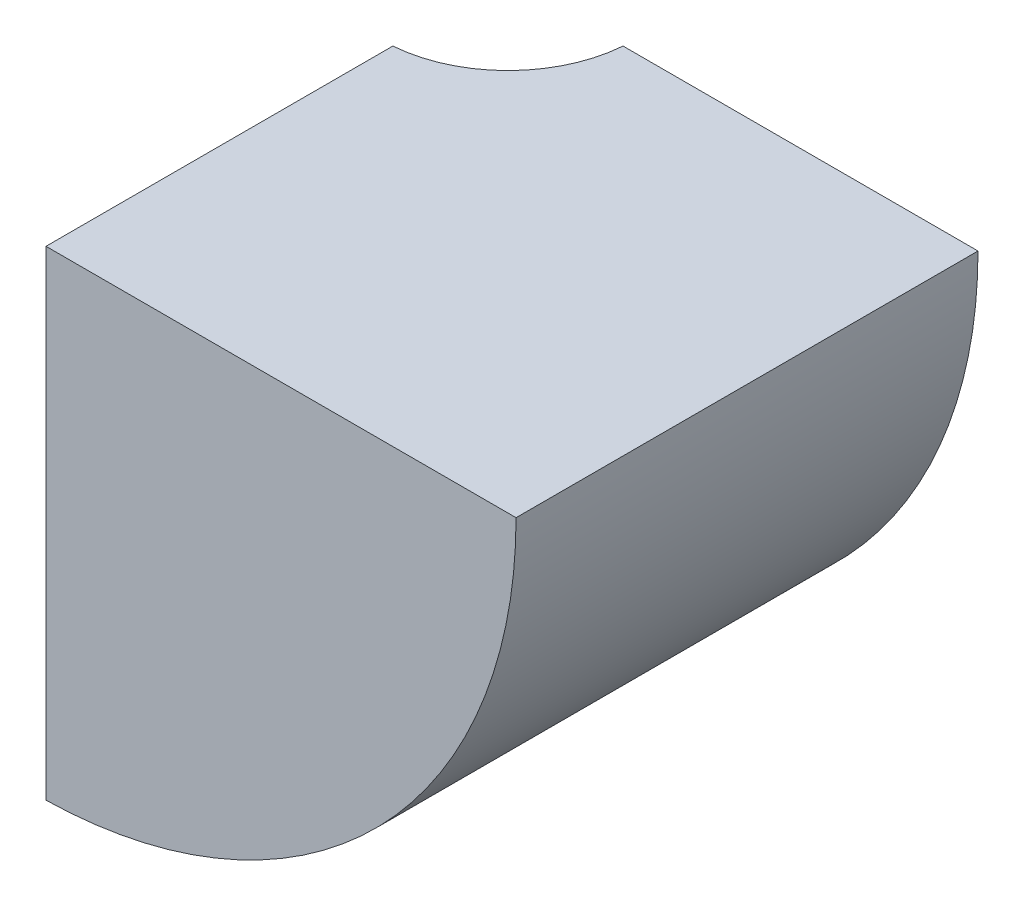
from build123d import *

# Parameters (mm, degrees)
SKETCH1_R           = 29.5
BOSS_EXTRUDE1_DEPTH = 29
CUT_EXTRUDE1_DEPTH  = 51.808463862
SKETCH3_R           = 7.7
CUT_EXTRUDE2_DEPTH  = 51.808463862
SKETCH4_W           = 0.6
SKETCH4_H           = 22.211954595
SKETCH4_W_2         = 23.241543893
SKETCH4_H_2         = 0.6
CUT_EXTRUDE3_DEPTH  = 51.808464035


with BuildPart() as part:
    # Sketch1 → Boss-Extrude1 (new body)
    with BuildSketch(Plane.XY):
        with Locations(Location((0, 0, 0), (0, 0, 180))):
            Circle(SKETCH1_R)
    extrude(amount=BOSS_EXTRUDE1_DEPTH)

    # Sketch2 → Cut-Extrude1 (cut, through all)
    with BuildSketch(Plane.XY.offset(29)):
        with BuildLine():
            Line((0, 0), (29.5, 0))
            ThreePointArc((29.5, 0), (-20.859650045, 20.859650045), (0, -29.5))
            Line((0, -29.5), (0, 0))
        make_face()
    extrude(amount=-CUT_EXTRUDE1_DEPTH, mode=Mode.SUBTRACT)

    # Sketch3 → Cut-Extrude2 (cut, through all)
    with BuildSketch(Plane(origin=(0, 0, 0), x_dir=(1, 0, 0), z_dir=(0, 1, 0))):
        Circle(SKETCH3_R)
    extrude(amount=-CUT_EXTRUDE2_DEPTH, mode=Mode.SUBTRACT)

    # Sketch4 → Cut-Extrude3 (cut, through all)
    with BuildSketch(Plane(origin=(0, 0, 0), x_dir=(1, 0, 0), z_dir=(0, 1, 0))):
        with Locations((0.3, -17.894022703)):
            Rectangle(SKETCH4_W, SKETCH4_H)
        with Locations((17.879228054, -0.3)):
            Rectangle(SKETCH4_W_2, SKETCH4_H_2)
    extrude(amount=-CUT_EXTRUDE3_DEPTH, mode=Mode.SUBTRACT)


solid = part.part
